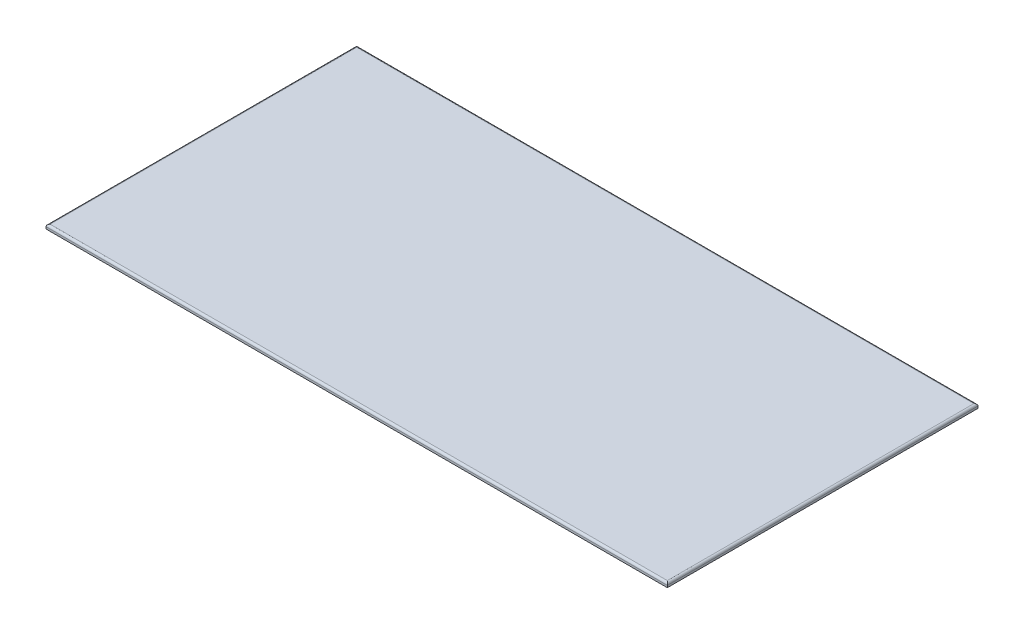
from build123d import *

# Parameters (mm, degrees)
SKETCH_1_W      = 1200
SKETCH_1_H      = 600
EXTRUDE_1_DEPTH = 8
FILLET_1_R      = 4


with BuildPart() as part:
    # Эскиз1 → Бобышка-Вытянуть1 (new body)
    with BuildSketch(Plane(origin=(0, 0, 0), x_dir=(1, 0, 0), z_dir=(0, 1, 0))):
        with Locations((600, 300)):
            Rectangle(SKETCH_1_W, SKETCH_1_H)
    extrude(amount=EXTRUDE_1_DEPTH)

    # Скругление1
    fillet_1_edges = [part.edges().sort_by_distance(p)[0] for p in [
        (1200, 8, -300),
        (600, 8, -600),
        (0, 8, -300),
        (600, 8, 0),
    ]]
    fillet(fillet_1_edges, radius=FILLET_1_R)


solid = part.part
